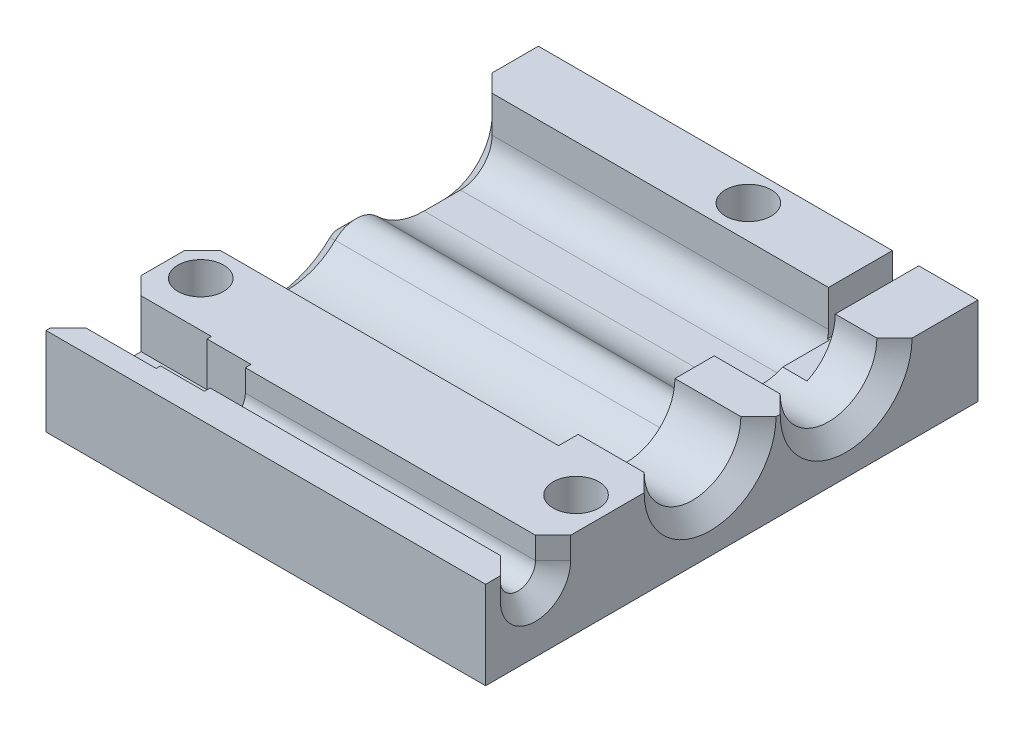
from build123d import *

# Parameters (mm, degrees)
SKETCH1_W                  = 50
SKETCH1_H                  = 56
BOSS_EXTRUDE1_DEPTH        = 10
SKETCH2_R                  = 5.5
CUT_EXTRUDE1_DEPTH         = 59.172158289
CUT_EXTRUDE2_DEPTH         = 40.5
FILLET1_R                  = 3.6
F_5_2_5_2_DIAMETER_HOLE1_D = 5.2
SKETCH7_W                  = 3
SKETCH7_H                  = 29.868058684
CUT_EXTRUDE3_DEPTH         = 5
SKETCH8_W                  = 5.3
SKETCH8_H                  = 10
CUT_EXTRUDE4_DEPTH         = 15
CUT_EXTRUDE5_DEPTH         = 46.923850013
SKETCH10_W                 = 6.3
SKETCH10_H                 = 11
CUT_EXTRUDE6_DEPTH         = 10
CHAMFER1_SIZE              = 2
CHAMFER2_SIZE              = 2
SKETCH12_W                 = 1.5
SKETCH12_H                 = 0.75
SKETCH12_W_2               = 0.75
SKETCH12_H_2               = 1.5
CUT_EXTRUDE_THIN1_DEPTH    = 0.5


with BuildPart() as part:
    # Sketch1 → Boss-Extrude1 (new body)
    with BuildSketch(Plane(origin=(0, 0, 0), x_dir=(1, 0, 0), z_dir=(0, 1, 0))):
        Rectangle(SKETCH1_W, SKETCH1_H)
    extrude(amount=BOSS_EXTRUDE1_DEPTH)

    # Sketch2 → Cut-Extrude1 (cut, through all)
    with BuildSketch(Plane.ZY.offset(25)):
        with Locations((-13, 10)):
            Circle(SKETCH2_R)
        with Locations((2.468847143, 10)):
            Circle(SKETCH2_R)
    extrude(amount=-CUT_EXTRUDE1_DEPTH, mode=Mode.SUBTRACT)

    # Sketch3 → Cut-Extrude2 (cut)
    with BuildSketch(Plane.ZY.offset(25)):
        with BuildLine():
            Line((-20.736152857, 16.807330276), (-20.736152857, 2.265))
            Line((-20.736152857, 2.265), (-13.001152857, 2.265))
            ThreePointArc((-13.001152857, 2.265), (-10.106686283, 2.826974958), (-7.632806065, 4.431240918))
            ThreePointArc((-7.632806065, 4.431240918), (-5.266152857, 5.386235298), (-2.899499649, 4.431240918))
            ThreePointArc((-2.899499649, 4.431240918), (10.132273811, 8.950182537), (-1.204091668, 16.807330276))
            Line((-1.204091668, 16.807330276), (-20.736152857, 16.807330276))
        make_face()
    extrude(amount=-CUT_EXTRUDE2_DEPTH, mode=Mode.SUBTRACT)

    # Fillet1
    fillet1_edges = [part.edges().sort_by_distance(p)[0] for p in [
        (-4.75, 2.265, -20.736152857),
    ]]
    fillet(fillet1_edges, radius=FILLET1_R)

    # Ø5.2 (5.2) Diameter Hole1 (through all)
    with Locations(Plane(origin=(0, 10, 0), x_dir=(1, 0, 0), z_dir=(0, 1, 0))):
        with Locations((2.378026924, 24.5), (21.342971966, -14.059218087), (-21.342971966, -14.059218087)):
            Hole(F_5_2_5_2_DIAMETER_HOLE1_D / 2)

    # Sketch7 → Cut-Extrude3 (cut)
    with BuildSketch(Plane(origin=(0, 10, 0), x_dir=(1, 0, 0), z_dir=(0, 1, 0))):
        with Locations((16.76197527, 27.631709684)):
            Rectangle(SKETCH7_W, SKETCH7_H)
    extrude(amount=-CUT_EXTRUDE3_DEPTH, mode=Mode.SUBTRACT)

    # Sketch8 → Cut-Extrude4 (cut)
    with BuildSketch(Plane.ZY.offset(25)):
        with Locations((22.329609043, 10)):
            Rectangle(SKETCH8_W, SKETCH8_H)
    extrude(amount=-CUT_EXTRUDE4_DEPTH, mode=Mode.SUBTRACT)

    # Sketch9 → Cut-Extrude5 (cut, through all)
    with BuildSketch(Plane.ZY.offset(10)):
        with BuildLine():
            Line((24.329609043, 12.5), (24.329609043, 7.5))
            ThreePointArc((24.329609043, 7.5), (22.329609043, 5.5), (20.329609043, 7.5))
            Line((20.329609043, 7.5), (20.329609043, 12.5))
            ThreePointArc((20.329609043, 12.5), (22.329609043, 14.5), (24.329609043, 12.5))
        make_face()
    extrude(amount=-CUT_EXTRUDE5_DEPTH, mode=Mode.SUBTRACT)

    # Sketch10 → Cut-Extrude6 (cut)
    with BuildSketch(Plane.ZY.offset(25)):
        with Locations((22.329609043, 10)):
            Rectangle(SKETCH10_W, SKETCH10_H)
    extrude(amount=-CUT_EXTRUDE6_DEPTH, mode=Mode.SUBTRACT)

    # Chamfer1
    chamfer1_edges = [part.edges().sort_by_distance(p)[0] for p in [
        (-25, 7.25, 25.479609043),
        (-25, 7.25, 19.179609043),
        (-25, 4.5, 22.329609043),
        (-25, 7.9325, -20.736152857),
        (-25, 2.826974958, -10.106686283),
        (-25, 5.386235298, -5.266152857),
        (-25, 2.881208409, 5.494244849),
        (-25, 2.265, -15.068652857),
        (-25, 3.319415588, -19.681737269),
    ]]
    chamfer(chamfer1_edges, length=CHAMFER1_SIZE)

    # Chamfer2
    chamfer2_edges = [part.edges().sort_by_distance(p)[0] for p in [
        (25, 8.75, 24.329609043),
        (25, 8.75, 20.329609043),
        (25, 5.5, 22.329609043),
        (25, 4.5, -13),
        (25, 4.5, 2.468847143),
    ]]
    chamfer(chamfer2_edges, length=CHAMFER2_SIZE)

    # Sketch12 → Cut-Extrude-Thin1 (cut)
    with BuildSketch(Plane(origin=(0, 5, 0), x_dir=(1, 0, 0), z_dir=(0, 1, 0))):
        with Locations((-12.5, -22.329609043)):
            Rectangle(SKETCH12_W, SKETCH12_H)
        with Locations((-12.5, -22.329609043)):
            Rectangle(SKETCH12_W_2, SKETCH12_H_2)
    extrude(amount=-CUT_EXTRUDE_THIN1_DEPTH, mode=Mode.SUBTRACT)


solid = part.part
